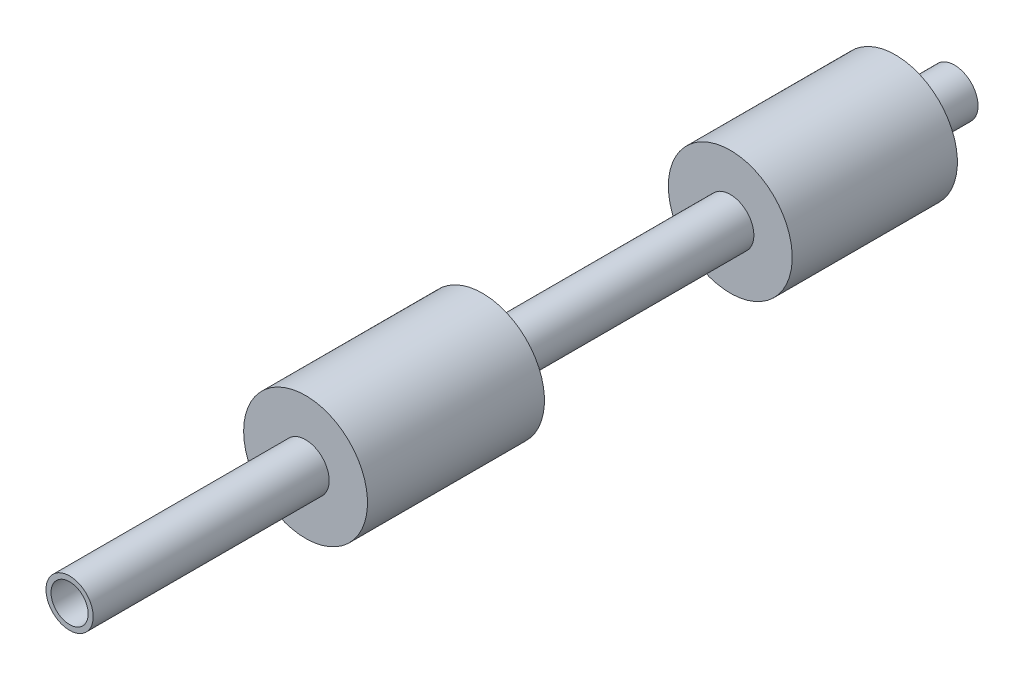
from build123d import *

# Parameters (mm, degrees)
SKETCH_1_R          = 4
SKETCH_1_R_2        = 3.15
EXTRUDE_1_DEPTH     = 149
EXTRUDE_START       = 1
SKETCH_3_R          = 4
EXTRUDE_2_DEPTH     = 1
EXTRUDE_START_2     = -80
SKETCH_4_2_R        = 10.5
SKETCH_4_2_R_2      = 4
EXTRUDE_4_DEPTH     = 30
EXTRUDE_START_3     = -10
SKETCH_4_R          = 10.5
SKETCH_4_R_2        = 4
EXTRUDE_3_DEPTH     = 28
SKETCH_5_R          = 3.15
CUT_EXTRUDE_1_DEPTH = 10


with BuildPart() as part:
    # 草图1 → 凸台-拉伸1 (new body)
    with BuildSketch(Plane.XY):
        Circle(SKETCH_1_R)
        Circle(SKETCH_1_R_2, mode=Mode.SUBTRACT)
    extrude(amount=EXTRUDE_1_DEPTH)

    # 草图3 → 凸台-拉伸2 (add)
    with BuildSketch(Plane(origin=(0, 0, 0), x_dir=(-1, 0, 0), z_dir=(0, 0, -1)).offset(EXTRUDE_START)):
        Circle(SKETCH_3_R)
    extrude(amount=-EXTRUDE_2_DEPTH)

    # 草图4<2> → 凸台-拉伸4 (add)
    with BuildSketch(Plane(origin=(0, 0, -1), x_dir=(-1, 0, 0), z_dir=(0, 0, -1)).offset(EXTRUDE_START_2)):
        Circle(SKETCH_4_2_R)
        Circle(SKETCH_4_2_R_2, mode=Mode.SUBTRACT)
    extrude(amount=-EXTRUDE_4_DEPTH)

    # 草图4 → 凸台-拉伸3 (add)
    with BuildSketch(Plane(origin=(0, 0, -1), x_dir=(-1, 0, 0), z_dir=(0, 0, -1)).offset(EXTRUDE_START_3)):
        Circle(SKETCH_4_R)
        Circle(SKETCH_4_R_2, mode=Mode.SUBTRACT)
    extrude(amount=-EXTRUDE_3_DEPTH)

    # 草图5 → 切除-拉伸1 (cut)
    with BuildSketch(Plane(origin=(0, 0, -1), x_dir=(-1, 0, 0), z_dir=(0, 0, -1))):
        Circle(SKETCH_5_R)
    extrude(amount=-CUT_EXTRUDE_1_DEPTH, mode=Mode.SUBTRACT)


solid = part.part
